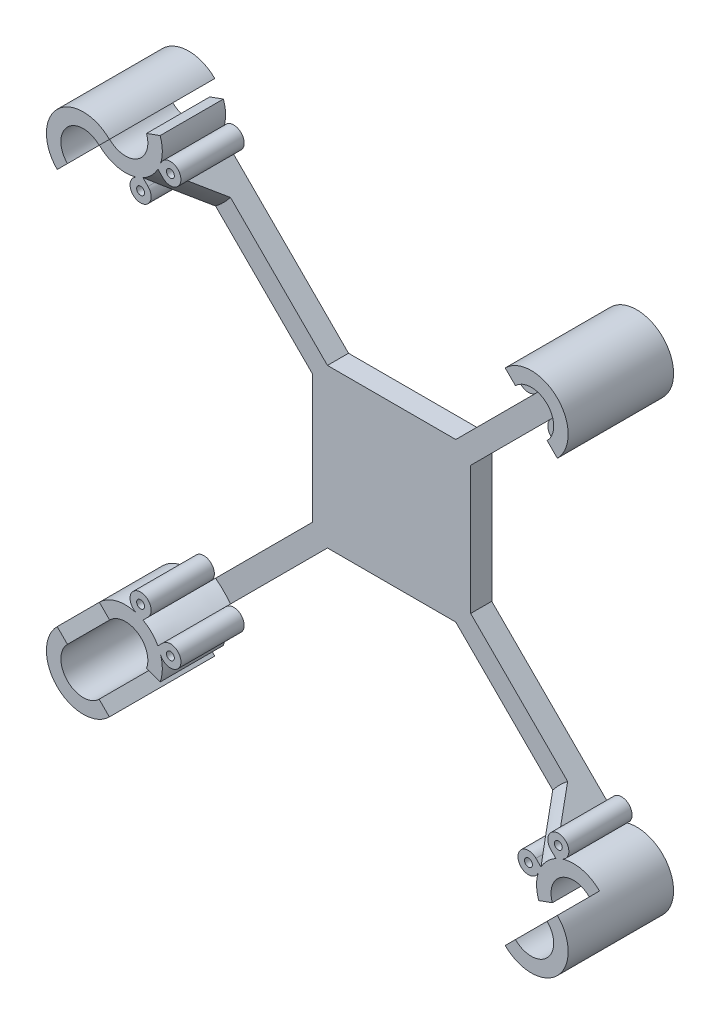
from build123d import *

# Parameters (mm, degrees)
RESSALTO_EXTRUS_O1_DEPTH = 4
RESSALTO_EXTRUS_O2_DEPTH = 20
CHANFRO1_SIZE            = 8
CORTE_EXTRUS_O1_DEPTH    = 8
RESSALTO_EXTRUS_O3_START = -12
ESBO_O3_R                = 0.7499999999999987
ESBO_O3_R_2              = 0.7499999999999968
ESBO_O3_R_3              = 0.7500000000000008
ESBO_O3_R_4              = 0.7500000000000033
ESBO_O3_R_5              = 0.7499999999999941
RESSALTO_EXTRUS_O3_DEPTH = 12


with BuildPart() as part:
    # Esboço1 → Ressalto-extrusão1 (new body)
    with BuildSketch(Plane.XY):
        with BuildLine():
            ThreePointArc((39.17079707212046, 36.342369947374344), (37.5502525316941, 37.55025253169418), (36.342369947374266, 39.17079707212054))
            Line((36.342369947374266, 39.17079707212054), (12.171572875253798, 15))
            Line((12.171572875253798, 15), (-12.171572875253808, 15))
            Line((-12.171572875253808, 15), (-36.342369947374394, 39.17079707212054))
            ThreePointArc((-36.342369947374394, 39.17079707212054), (-37.55025253169423, 37.550252531694184), (-39.170797072120585, 36.34236994737435))
            Line((-39.1707970721206, 36.34236994737438), (-15.000000000000007, 12.171572875253808))
            Line((-15.000000000000007, 12.171572875253808), (-15.000000000000034, -12.171572875253805))
            Line((-15.000000000000034, -12.171572875253805), (-39.1707970721206, -36.34236994737438))
            ThreePointArc((-39.170797072120585, -36.34236994737435), (-37.55025253169423, -37.550252531694184), (-36.342369947374394, -39.17079707212054))
            Line((-36.342369947374394, -39.17079707212054), (-12.171572875253837, -14.999999999999996))
            Line((-12.171572875253837, -14.999999999999996), (12.171572875253744, -14.999999999999996))
            Line((12.171572875253743, -14.999999999999996), (36.342369947374266, -39.17079707212054))
            ThreePointArc((36.342369947374266, -39.17079707212054), (37.5502525316941, -37.55025253169418), (39.17079707212046, -36.342369947374344))
            Line((39.17079707212048, -36.34236994737438), (14.99999999999994, -12.171572875253805))
            Line((14.99999999999994, -12.171572875253805), (14.999999999999996, 12.171572875253808))
            Line((14.999999999999996, 12.171572875253808), (39.17079707212048, 36.34236994737438))
        make_face()
    extrude(amount=RESSALTO_EXTRUS_O1_DEPTH)

    # Esboço1<4> → Ressalto-extrusão2 (add)
    with BuildSketch(Plane.XY):
        with BuildLine():
            Line((-38.506306361659945, 43.95358560913411), (-35.92215165449871, 44.8941410032797))
            ThreePointArc((-35.92215165449871, 44.8941410032797), (-35.51879172736745, 41.98742702556037), (-36.342369947374394, 39.17079707212054))
            ThreePointArc((-36.342369947374394, 39.17079707212054), (-49.42666685814673, 41.489412924952944), (-37.5502525316942, 47.449747468305816))
            Line((-37.5502525316942, 47.449747468305816), (-39.49479617995721, 45.50520382004282))
            ThreePointArc((-39.49479617995721, 45.50520382004282), (-46.08441364470481, 40.216476664526006), (-38.506306361659945, 43.95358560913411))
        make_face()
        with BuildLine():
            ThreePointArc((36.342369947374266, 39.17079707212054), (49.426666858146646, 41.48941292495294), (37.550252531694085, 47.449747468305816))
            Line((37.550252531694085, 47.449747468305816), (39.494796179957106, 45.50520382004282))
            ThreePointArc((39.494796179957106, 45.50520382004282), (46.08441364470471, 40.216476664526006), (38.50630636165983, 43.95358560913411))
            Line((38.50630636165983, 43.95358560913411), (35.922151654498585, 44.8941410032797))
            ThreePointArc((35.922151654498585, 44.8941410032797), (35.51879172736732, 41.98742702556037), (36.342369947374266, 39.17079707212054))
        make_face()
        with BuildLine():
            ThreePointArc((35.922151654498585, -44.8941410032797), (35.51879172736732, -41.98742702556037), (36.342369947374266, -39.17079707212054))
            ThreePointArc((36.342369947374266, -39.17079707212054), (49.426666858146646, -41.48941292495294), (37.550252531694085, -47.449747468305816))
            Line((37.550252531694085, -47.449747468305816), (39.494796179957106, -45.50520382004282))
            ThreePointArc((39.494796179957106, -45.50520382004282), (46.08441364470471, -40.216476664526006), (38.50630636165983, -43.95358560913411))
            Line((38.50630636165983, -43.95358560913411), (35.922151654498585, -44.8941410032797))
        make_face()
        with BuildLine():
            ThreePointArc((-35.92215165449871, -44.8941410032797), (-35.51879172736745, -41.98742702556037), (-36.342369947374394, -39.17079707212054))
            ThreePointArc((-36.342369947374394, -39.17079707212054), (-49.42666685814673, -41.489412924952944), (-37.5502525316942, -47.449747468305816))
            Line((-37.5502525316942, -47.449747468305816), (-39.49479617995721, -45.50520382004282))
            ThreePointArc((-39.49479617995721, -45.50520382004282), (-46.08441364470481, -40.216476664526006), (-38.506306361659945, -43.95358560913411))
            Line((-38.506306361659945, -43.95358560913411), (-35.92215165449871, -44.8941410032797))
        make_face()
    extrude(amount=RESSALTO_EXTRUS_O2_DEPTH)

    # Chanfro1
    chanfro1_edges = [part.edges().sort_by_distance(p)[0] for p in [
        (37.5502525316941, 37.55025253169418, 4),
        (-37.55025253169423, 37.550252531694184, 4),
        (-37.55025253169423, -37.550252531694184, 4),
        (37.5502525316941, -37.55025253169418, 4),
    ]]
    chamfer(chanfro1_edges, length=CHANFRO1_SIZE)

    # Esboço2 → Corte-extrusão1 (cut)
    with BuildSketch(Plane.XY.offset(20)):
        Polygon((85.00000000000006, 0), (-2.776e-14, 85.00000000000007), (-85.00000000000007, -4.163e-14), (6.939e-14, -85.00000000000006), align=None)
    extrude(amount=-CORTE_EXTRUS_O1_DEPTH, mode=Mode.SUBTRACT)

    # Esboço3 → Ressalto-extrusão3 (add)
    # profile 1 of 8: a face of its own
    with BuildSketch(Plane(origin=(0, 0, 0), x_dir=(-1, 0, 0), z_dir=(0, 0, -1)).offset(RESSALTO_EXTRUS_O3_START)):
        with BuildLine():
            Line((38.21333643687745, 35.38490931213122), (39.17079707212057, 36.34236994737435))
            ThreePointArc((39.17079707212057, 36.34236994737435), (39.708159891817324, 36.0808389325129), (40.26587222163931, 35.866096694256335))
            ThreePointArc((40.26587222163931, 35.866096694256335), (40.08404443190525, 32.02348933210357), (38.21333643687745, 35.38490931213122))
        make_face()
        with Locations((39.627549999250526, 33.97069574975814)):
            Circle(ESBO_O3_R, mode=Mode.SUBTRACT)
    # profile 2 of 8: a face of its own
    with BuildSketch(Plane(origin=(0, 0, 0), x_dir=(-1, 0, 0), z_dir=(0, 0, -1)).offset(RESSALTO_EXTRUS_O3_START)):
        with BuildLine():
            Line((35.38490931213124, 38.21333643687742), (36.342369947374365, 39.17079707212055))
            ThreePointArc((36.342369947374365, 39.17079707212055), (36.08083893251292, 39.7081598918173), (35.86609669425635, 40.265872221639285))
            ThreePointArc((35.86609669425635, 40.265872221639285), (32.02348933210358, 40.08404443190522), (35.38490931213124, 38.21333643687742))
        make_face()
        with Locations((33.97069574975816, 39.6275499992505)):
            Circle(ESBO_O3_R, mode=Mode.SUBTRACT)
    # profile 3 of 8: a face of its own
    with BuildSketch(Plane(origin=(0, 0, 0), x_dir=(-1, 0, 0), z_dir=(0, 0, -1)).offset(RESSALTO_EXTRUS_O3_START)):
        with BuildLine():
            Line((35.38490931213109, -38.21333643687757), (36.342369947374216, -39.1707970721207))
            ThreePointArc((36.342369947374216, -39.1707970721207), (36.08083893251276, -39.70815989181745), (35.86609669425619, -40.265872221639434))
            ThreePointArc((35.86609669425619, -40.265872221639434), (32.023489332103416, -40.08404443190537), (35.38490931213109, -38.21333643687757))
        make_face()
        with Locations((33.970695749758, -39.62754999925065)):
            Circle(ESBO_O3_R, mode=Mode.SUBTRACT)
    # profile 4 of 8: a face of its own
    with BuildSketch(Plane(origin=(0, 0, 0), x_dir=(-1, 0, 0), z_dir=(0, 0, -1)).offset(RESSALTO_EXTRUS_O3_START)):
        with BuildLine():
            Line((38.21333643687729, -35.38490931213138), (39.17079707212043, -36.34236994737451))
            ThreePointArc((39.17079707212043, -36.34236994737451), (39.70815989181718, -36.08083893251306), (40.26587222163916, -35.866096694256484))
            ThreePointArc((40.26587222163916, -35.866096694256484), (40.08404443190512, -32.02348933210371), (38.21333643687729, -35.38490931213138))
        make_face()
        with Locations((39.627549999250384, -33.97069574975829)):
            Circle(ESBO_O3_R, mode=Mode.SUBTRACT)
    # profile 5 of 8: a face of its own
    with BuildSketch(Plane(origin=(0, 0, 0), x_dir=(-1, 0, 0), z_dir=(0, 0, -1)).offset(RESSALTO_EXTRUS_O3_START)):
        with BuildLine():
            Line((-38.2133364368777, -35.38490931213096), (-39.17079707212083, -36.34236994737408))
            ThreePointArc((-39.17079707212083, -36.34236994737408), (-39.70815989181758, -36.08083893251263), (-40.26587222163956, -35.86609669425605))
            ThreePointArc((-40.26587222163956, -35.86609669425605), (-40.08404443190547, -32.02348933210329), (-38.2133364368777, -35.38490931213096))
        make_face()
        with Locations((-39.62754999925076, -33.970695749757866)):
            Circle(ESBO_O3_R_2, mode=Mode.SUBTRACT)
    # profile 6 of 8: a face of its own
    with BuildSketch(Plane(origin=(0, 0, 0), x_dir=(-1, 0, 0), z_dir=(0, 0, -1)).offset(RESSALTO_EXTRUS_O3_START)):
        with BuildLine():
            Line((-35.384909312131505, -38.213336436877164), (-36.342369947374635, -39.170797072120294))
            ThreePointArc((-36.342369947374635, -39.170797072120294), (-36.08083893251319, -39.70815989181705), (-35.86609669425663, -40.265872221639036))
            ThreePointArc((-35.86609669425663, -40.265872221639036), (-32.02348933210386, -40.084044431905006), (-35.384909312131505, -38.213336436877164))
        make_face()
        with Locations((-33.970695749758434, -39.62754999925026)):
            Circle(ESBO_O3_R_3, mode=Mode.SUBTRACT)
    # profile 7 of 8: a face of its own
    with BuildSketch(Plane(origin=(0, 0, 0), x_dir=(-1, 0, 0), z_dir=(0, 0, -1)).offset(RESSALTO_EXTRUS_O3_START)):
        with BuildLine():
            Line((-35.38490931213082, 38.213336436877796), (-36.34236994737394, 39.17079707212094))
            ThreePointArc((-36.34236994737394, 39.17079707212094), (-36.080838932512485, 39.708159891817694), (-35.86609669425591, 40.265872221639675))
            ThreePointArc((-35.86609669425591, 40.265872221639675), (-32.02348933210314, 40.084044431905575), (-35.38490931213082, 38.213336436877796))
        make_face()
        with Locations((-33.97069574975772, 39.62754999925087)):
            Circle(ESBO_O3_R_4, mode=Mode.SUBTRACT)
    # profile 8 of 8: a face of its own
    with BuildSketch(Plane(origin=(0, 0, 0), x_dir=(-1, 0, 0), z_dir=(0, 0, -1)).offset(RESSALTO_EXTRUS_O3_START)):
        with BuildLine():
            Line((-38.21333643687705, 35.38490931213163), (-39.17079707212017, 36.34236994737476))
            ThreePointArc((-39.17079707212017, 36.34236994737476), (-39.708159891816926, 36.08083893251332), (-40.26587222163891, 35.866096694256754))
            ThreePointArc((-40.26587222163891, 35.866096694256754), (-40.0840444319049, 32.02348933210398), (-38.21333643687705, 35.38490931213163))
        make_face()
        with Locations((-39.62754999925015, 33.970695749758555)):
            Circle(ESBO_O3_R_5, mode=Mode.SUBTRACT)
    extrude(amount=RESSALTO_EXTRUS_O3_DEPTH)


solid = part.part
